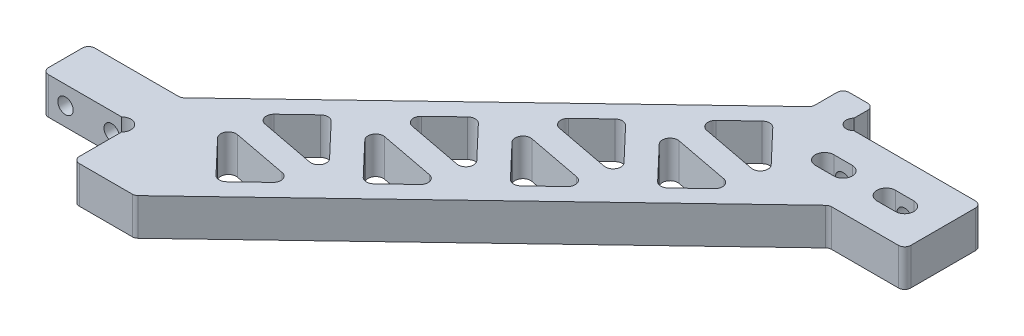
from build123d import *

# Parameters (mm, degrees)
EXTRUDE_1_DEPTH     = 3
FILLET_2_R          = 1
CUT_EXTRUDE_1_DEPTH = 6
FILLET_3_R          = 1.25
SKETCH_6_R          = 1.25
CUT_EXTRUDE_4_DEPTH = 108.570906848
SKETCH_7_R          = 1.25
CUT_EXTRUDE_5_DEPTH = 8


with BuildPart() as part:
    # ｽｹｯﾁ1 → ﾎﾞｽ - 押し出し1 (new, symmetric)
    with BuildSketch(Plane(origin=(0, 0, 0), x_dir=(1, 0, 0), z_dir=(0, 1, 0))):
        with BuildLine():
            Line((7.5, -2.121320344), (7.5, -10))
            Line((7.5, -10), (17.5, -10))
            Line((17.5, -10), (75.25, 45))
            Line((75.25, 45), (87.5, 45))
            Line((87.5, 45), (87.5, 57.5))
            Line((87.5, 57.5), (66.767766953, 57.5))
            ThreePointArc((66.767766953, 57.5), (65.883883476, 57.133883476), (65, 57.5))
            ThreePointArc((65, 57.5), (64.633883476, 58.383883476), (65, 59.267766953))
            Line((65, 59.267766953), (65, 62.5))
            Line((65, 62.5), (60, 62.5))
            Line((60, 62.5), (60, 57.5))
            Line((60, 57.5), (7.5, 7.5))
            Line((7.5, 7.5), (-7.5, 7.5))
            Line((-7.5, 7.5), (-7.5, 0))
            Line((-7.5, 0), (5.378679656, 0))
            ThreePointArc((5.378679656, 0), (6.439339828, 0.439339828), (7.5, 0))
            ThreePointArc((7.5, 0), (7.825159127, -0.486635023), (7.939339828, -1.060660172))
            ThreePointArc((7.939339828, -1.060660172), (7.825159127, -1.63468532), (7.5, -2.121320344))
        make_face()
        with BuildLine():
            ThreePointArc((68.5, 49.5), (67, 51), (68.5, 52.5))
            Line((68.5, 52.5), (71.5, 52.5))
            ThreePointArc((71.5, 52.5), (73, 51), (71.5, 49.5))
            Line((71.5, 49.5), (68.5, 49.5))
        make_face(mode=Mode.SUBTRACT)
        with BuildLine():
            ThreePointArc((78.5, 49.5), (77, 51), (78.5, 52.5))
            Line((78.5, 52.5), (81.5, 52.5))
            ThreePointArc((81.5, 52.5), (83, 51), (81.5, 49.5))
            Line((81.5, 49.5), (78.5, 49.5))
        make_face(mode=Mode.SUBTRACT)
    extrude(amount=EXTRUDE_1_DEPTH, both=True)

    # ﾌｨﾚｯﾄ2
    fillet_2_edges = [part.edges().sort_by_distance(p)[0] for p in [
        (87.5, -1.5, -57.5),
        (87.5, -1.5, -45),
        (75.25, -1.5, -45),
        (17.5, -1.5, 10),
        (7.5, -1.5, 10),
        (-7.5, -1.5, 0),
        (-7.5, -1.5, -7.5),
        (7.5, -1.5, -7.5),
        (60, -1.5, -57.5),
        (60, -1.5, -62.5),
        (65, -1.5, -62.5),
    ]]
    fillet(fillet_2_edges, radius=FILLET_2_R)

    # ｽｹｯﾁ2 → ｶｯﾄ - 押し出し1 (cut)
    with BuildSketch(Plane(origin=(0, 3, 0), x_dir=(1, 0, 0), z_dir=(0, 1, 0))):
        Polygon((58.862068966, 52.273399015), (52.344827586, 46.066502463), (67.530321046, 43.17173433), align=None)
        Polygon((50.171921182, 42.616115412), (65.357414642, 39.721347279), (58.840173263, 33.514450727), align=None)
        Polygon((46.619704433, 40.614004222), (40.102463054, 34.407107671), (55.287956514, 31.512339537), align=None)
        Polygon((37.92955665, 30.956720619), (53.11505011, 28.061952486), (46.597808731, 21.855055934), align=None)
        Polygon((34.377339901, 28.95460943), (27.860098522, 22.747712878), (43.045591982, 19.852944745), align=None)
        Polygon((25.687192118, 19.297325827), (40.872685578, 16.402557694), (34.355444199, 10.195661142), align=None)
        Polygon((22.134975369, 17.295214638), (15.61773399, 11.088318086), (30.80322745, 8.193549953), align=None)
        Polygon((13.444827586, 7.637931034), (28.630321046, 4.743162901), (22.113079667, -1.46373365), align=None)
    extrude(amount=-CUT_EXTRUDE_1_DEPTH, mode=Mode.SUBTRACT)

    # ﾌｨﾚｯﾄ3
    fillet_3_edges = [part.edges().sort_by_distance(p)[0] for p in [
        (58.862068966, 0, -52.273399015),
        (67.530321046, 0, -43.17173433),
        (52.344827586, 0, -46.066502463),
        (46.619704433, 0, -40.614004222),
        (55.287956514, 0, -31.512339537),
        (40.102463054, 0, -34.407107671),
        (58.840173263, 0, -33.514450727),
        (50.171921182, 0, -42.616115412),
        (65.357414642, 0, -39.721347279),
        (34.377339901, 0, -28.95460943),
        (43.045591982, 0, -19.852944745),
        (27.860098522, 0, -22.747712878),
        (46.597808731, 0, -21.855055934),
        (37.92955665, 0, -30.956720619),
        (53.11505011, 0, -28.061952486),
        (22.134975369, 0, -17.295214638),
        (30.80322745, 0, -8.193549953),
        (15.61773399, 0, -11.088318086),
        (34.355444199, 0, -10.195661142),
        (25.687192118, 0, -19.297325827),
        (40.872685578, 0, -16.402557694),
        (22.113079667, 0, 1.46373365),
        (13.444827586, 0, -7.637931034),
        (28.630321046, 0, -4.743162901),
    ]]
    fillet(fillet_3_edges, radius=FILLET_3_R)

    # ｽｹｯﾁ6 → ｶｯﾄ - 押し出し4 (cut, through all)
    with BuildSketch(Plane.XY):
        with Locations((-3.75, 0)):
            Circle(SKETCH_6_R)
        with Locations(Location((3.75, 0, 0), (0, 0, 180))):
            Circle(SKETCH_6_R)
    extrude(amount=-CUT_EXTRUDE_4_DEPTH, mode=Mode.SUBTRACT)

    # ｽｹｯﾁ7 → ｶｯﾄ - 押し出し5 (cut)
    with BuildSketch(Plane(origin=(0, 0, -57.5), x_dir=(-1, 0, 0), z_dir=(0, 0, -1))):
        with Locations((-70, 0)):
            Circle(SKETCH_7_R)
        with Locations((-80, 0)):
            Circle(SKETCH_7_R)
    extrude(amount=-CUT_EXTRUDE_5_DEPTH, mode=Mode.SUBTRACT)


solid = part.part
